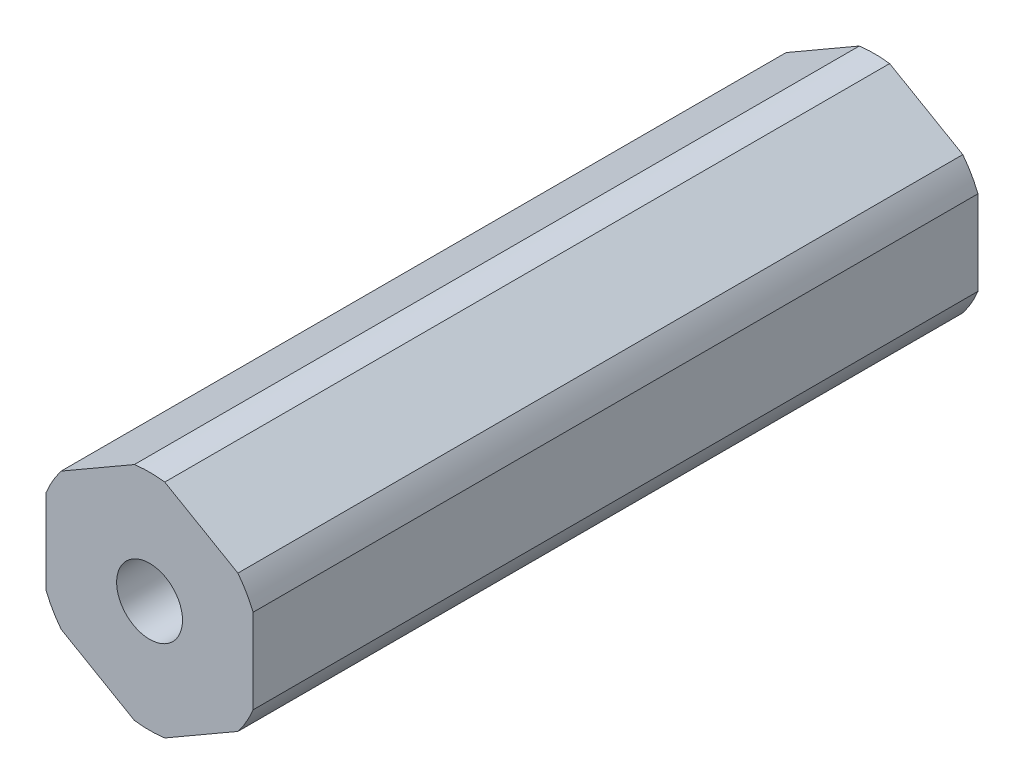
from build123d import *

# Parameters (mm, degrees)
BOSS_EXTRUDE1_DEPTH                  = 22.225
F_10_32_TAPPED_HOLE1_D               = 4.0386
F_10_32_TAPPED_HOLE1_DEPTH           = 11.938
F_10_32_TAPPED_HOLE1_TIP             = 1.213317848
F_10_32_TAPPED_HOLE1_ON_FACE_2_D     = 4.0386
F_10_32_TAPPED_HOLE1_ON_FACE_2_DEPTH = 11.938
F_10_32_TAPPED_HOLE1_ON_FACE_2_TIP   = 1.213317848


with BuildPart() as part:
    # Sketch1 → Boss-Extrude1 (new, symmetric)
    with BuildSketch(Plane.XY):
        with BuildLine():
            ThreePointArc((0.93173274, 6.79441227), (0, 6.858), (-0.93173274, 6.79441227))
            Line((-0.93173274, 6.79441227), (-5.41826726, 4.204110358))
            ThreePointArc((-5.41826726, 4.204110358), (-5.939202219, 3.429), (-6.35, 2.590301913))
            Line((-6.35, 2.590301913), (-6.35, -2.590301913))
            ThreePointArc((-6.35, -2.590301913), (-5.939202219, -3.429), (-5.41826726, -4.204110358))
            Line((-5.41826726, -4.204110358), (-0.93173274, -6.79441227))
            ThreePointArc((-0.93173274, -6.79441227), (0, -6.858), (0.93173274, -6.79441227))
            Line((0.93173274, -6.79441227), (5.41826726, -4.204110358))
            ThreePointArc((5.41826726, -4.204110358), (5.939202219, -3.429), (6.35, -2.590301913))
            Line((6.35, -2.590301913), (6.35, 2.590301913))
            ThreePointArc((6.35, 2.590301913), (5.939202219, 3.429), (5.41826726, 4.204110358))
            Line((5.41826726, 4.204110358), (0.93173274, 6.79441227))
        make_face()
    extrude(amount=BOSS_EXTRUDE1_DEPTH, both=True)

    # #10-32 Tapped Hole1
    with Locations(Plane(origin=(0, 0, -22.225), x_dir=(-1, 0, 0), z_dir=(0, 0, -1))):
        with Locations((0, 0)):
            Hole(F_10_32_TAPPED_HOLE1_D / 2, depth=F_10_32_TAPPED_HOLE1_DEPTH)
            with Locations((0, 0, -(F_10_32_TAPPED_HOLE1_DEPTH + F_10_32_TAPPED_HOLE1_TIP / 2))):  # 118° drill point
                Cone(0, F_10_32_TAPPED_HOLE1_D / 2, F_10_32_TAPPED_HOLE1_TIP, mode=Mode.SUBTRACT)

    # #10-32 Tapped Hole1 on face 2
    with Locations(Plane.XY.offset(22.225)):
        with Locations((0, 0)):
            Hole(F_10_32_TAPPED_HOLE1_ON_FACE_2_D / 2, depth=F_10_32_TAPPED_HOLE1_ON_FACE_2_DEPTH)
            with Locations((0, 0, -(F_10_32_TAPPED_HOLE1_ON_FACE_2_DEPTH + F_10_32_TAPPED_HOLE1_ON_FACE_2_TIP / 2))):  # 118° drill point
                Cone(0, F_10_32_TAPPED_HOLE1_ON_FACE_2_D / 2, F_10_32_TAPPED_HOLE1_ON_FACE_2_TIP, mode=Mode.SUBTRACT)


solid = part.part
